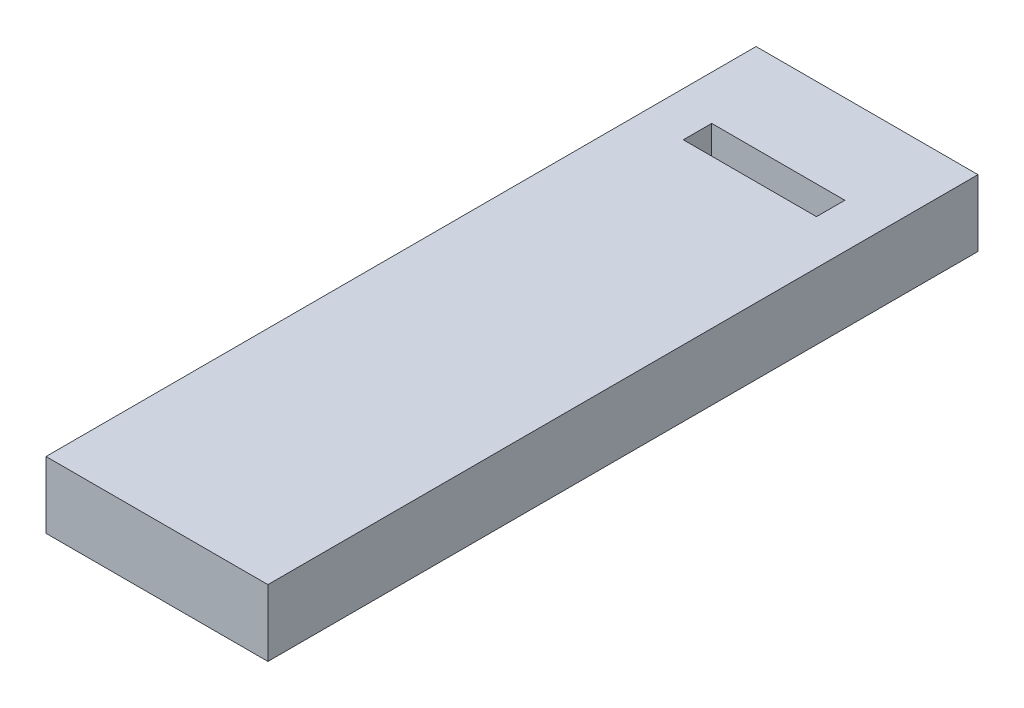
from build123d import *

# Parameters (mm, degrees)
SKETCH1_W           = 63.5
SKETCH1_H           = 203.2
BOSS_EXTRUDE1_DEPTH = 19.05
SKETCH2_R           = 4.7625
CUT_EXTRUDE1_DEPTH  = 25.4
CUT_EXTRUDE2_DEPTH  = 9.525
SKETCH5_W           = 38.1
SKETCH5_H           = 8.128
CUT_EXTRUDE4_DEPTH  = 109.136603424
SKETCH6_W           = 53.975
SKETCH6_H           = 33.655
CUT_EXTRUDE5_DEPTH  = 2.159


with BuildPart() as part:
    # Sketch1 → Boss-Extrude1 (new body)
    with BuildSketch(Plane(origin=(0, 0, 0), x_dir=(1, 0, 0), z_dir=(0, 1, 0))):
        Rectangle(SKETCH1_W, SKETCH1_H)
    extrude(amount=BOSS_EXTRUDE1_DEPTH)

    # Sketch2 → Cut-Extrude1 (cut)
    with BuildSketch(Plane(origin=(0, 0, -101.6), x_dir=(-1, 0, 0), z_dir=(0, 0, -1))):
        Circle(SKETCH2_R)
    extrude(amount=-CUT_EXTRUDE1_DEPTH, mode=Mode.SUBTRACT)

    # Sketch3 → Cut-Extrude2 (cut)
    with BuildSketch(Plane(origin=(0, 0, 0), x_dir=(-1, 0, 0), z_dir=(0, -1, 0))):
        with BuildLine():
            Line((-20.6375, -96.8375), (20.6375, -96.8375))
            ThreePointArc((20.6375, -96.8375), (25.127628061, -94.977628061), (26.9875, -90.4875))
            Line((26.9875, -90.4875), (26.9875, 37.592))
            ThreePointArc((26.9875, 37.592), (25.127628061, 42.082128061), (20.6375, 43.942))
            Line((20.6375, 43.942), (-20.6375, 43.942))
            ThreePointArc((-20.6375, 43.942), (-25.127628061, 42.082128061), (-26.9875, 37.592))
            Line((-26.9875, 37.592), (-26.9875, -90.4875))
            ThreePointArc((-26.9875, -90.4875), (-25.127628061, -94.977628061), (-20.6375, -96.8375))
        make_face()
        with BuildLine():
            Line((-23.8125, 76.2), (23.8125, 76.2))
            ThreePointArc((23.8125, 76.2), (26.05756403, 75.27006403), (26.9875, 73.025))
            Line((26.9875, 73.025), (26.9875, 71.247))
            ThreePointArc((26.9875, 71.247), (26.05756403, 69.00193597), (23.8125, 68.072))
            Line((23.8125, 68.072), (-23.8125, 68.072))
            ThreePointArc((-23.8125, 68.072), (-26.05756403, 69.00193597), (-26.9875, 71.247))
            Line((-26.9875, 71.247), (-26.9875, 73.025))
            ThreePointArc((-26.9875, 73.025), (-26.05756403, 75.27006403), (-23.8125, 76.2))
        make_face()
    extrude(amount=-CUT_EXTRUDE2_DEPTH, mode=Mode.SUBTRACT)

    # Sketch5 → Cut-Extrude4 (cut, through all)
    with BuildSketch(Plane(origin=(0, 0, 0), x_dir=(1, 0, 0), z_dir=(0, 1, 0))):
        with Locations((0, 72.136)):
            Rectangle(SKETCH5_W, SKETCH5_H)
    extrude(amount=CUT_EXTRUDE4_DEPTH, mode=Mode.SUBTRACT)

    # Sketch6 → Cut-Extrude5 (cut)
    with BuildSketch(Plane(origin=(0, 0, 0), x_dir=(1, 0, 0), z_dir=(0, 1, 0))):
        with Locations((0, 54.4195)):
            Rectangle(SKETCH6_W, SKETCH6_H)
    extrude(amount=CUT_EXTRUDE5_DEPTH, mode=Mode.SUBTRACT)


solid = part.part
